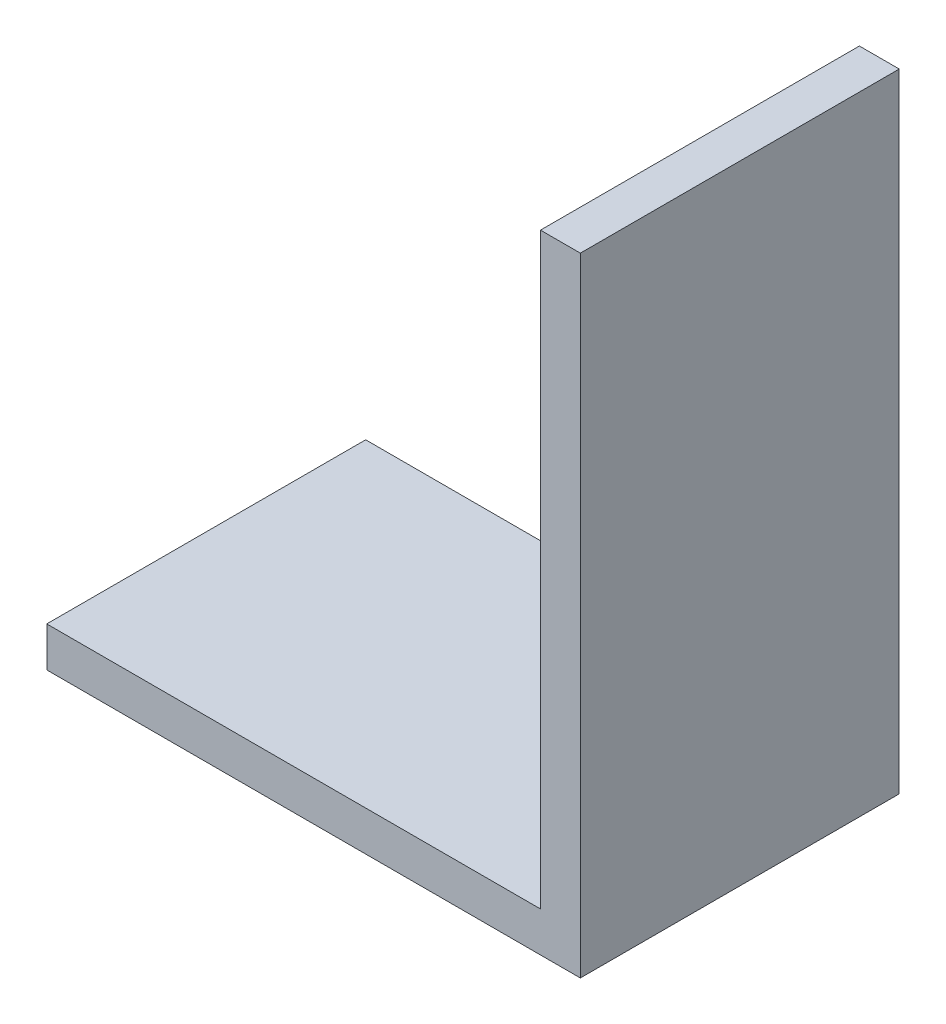
from build123d import *

# Parameters (mm, degrees)
BOSS_EXTRUDE1_DEPTH = 50.8


with BuildPart() as part:
    # Sketch1 → Boss-Extrude1 (new, symmetric)
    with BuildSketch(Plane.XY):
        Polygon((0, 200), (0, 0), (-170, 0), (-170, 12.7), (-12.7, 12.7), (-12.7, 200), align=None)
    extrude(amount=BOSS_EXTRUDE1_DEPTH, both=True)


solid = part.part
